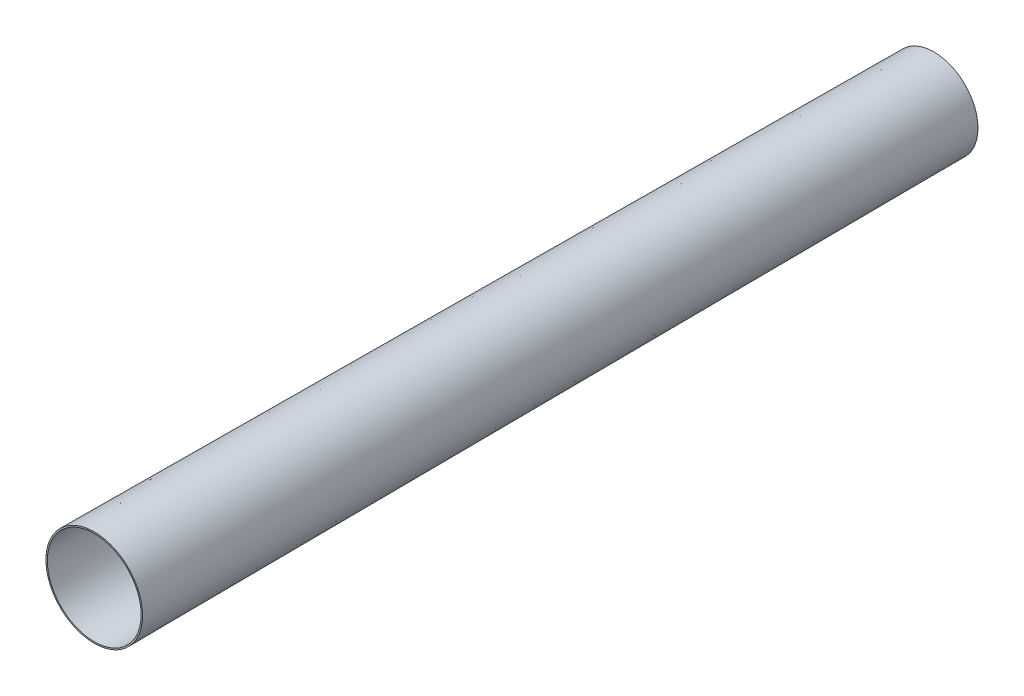
from build123d import *

# Parameters (mm, degrees)
SKETCH1_R = 15.815588174
SKETCH2_R = 17.366136035
SHELL1_T  = -0.5


with BuildPart() as part:
    # Sketch1 → Loft1 section 0
    with BuildSketch(Plane.XY):
        Circle(SKETCH1_R)
    # Sketch2 → Loft1 section 1
    with BuildSketch(Plane.XY.offset(301.83998346)):
        Circle(SKETCH2_R)
    loft()

    # Shell1
    shell1_openings = [part.faces().sort_by_distance(p)[0] for p in [
        (0, 0, 301.83998346),
        (0, 0, 0),
    ]]
    offset(amount=SHELL1_T, openings=shell1_openings, kind=Kind.INTERSECTION)


solid = part.part
